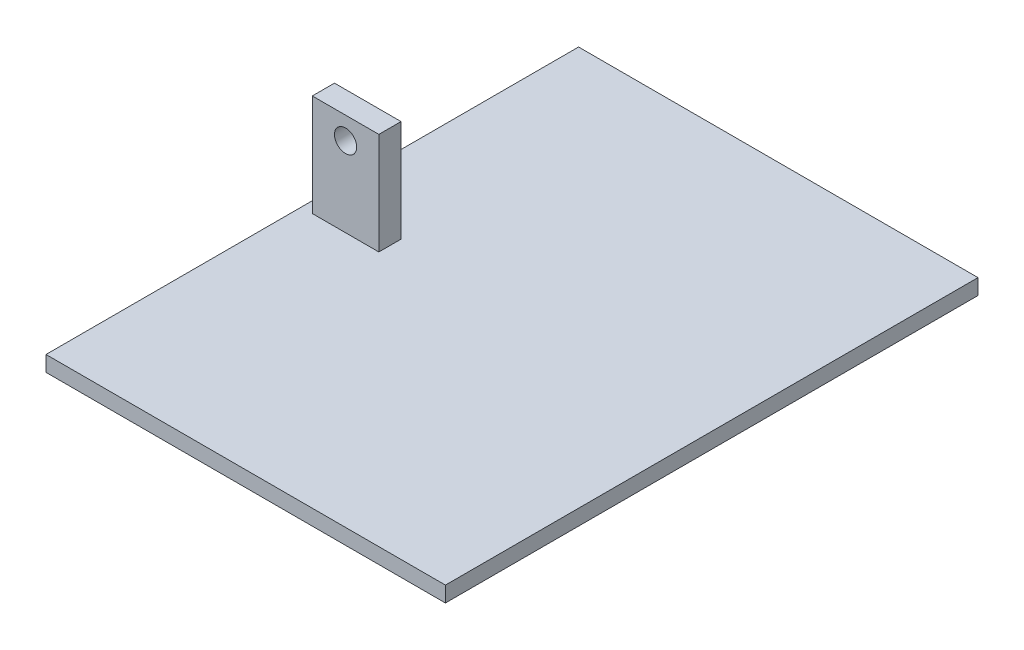
from build123d import *

# Parameters (mm, degrees)
SKETCH2_W               = 457.2
SKETCH2_H               = 609.6
SKETCH2_W_2             = 76.2
SKETCH2_H_2             = 25.4
BOSS_EXTRUDE1_DEPTH     = 17.78
SKETCH3_W               = 76.2
SKETCH3_H               = 25.4
BOSS_EXTRUDE2_DEPTH     = 116.586
SKETCH3_2_W             = 76.2
SKETCH3_2_H             = 25.4
BOSS_EXTRUDE3_DEPTH     = 17.78
CUT_EXTRUDE1_DEPTH      = 254
CUT_EXTRUDE1_DEPTH_BACK = 254
SKETCH4_R               = 12.7


with BuildPart() as part:
    # Sketch2 → Boss-Extrude1 (new body)
    with BuildSketch(Plane(origin=(0, 0, 0), x_dir=(1, 0, 0), z_dir=(0, 1, 0))):
        Rectangle(SKETCH2_W, SKETCH2_H)
        with Locations((-177.8, 0)):
            Rectangle(SKETCH2_W_2, SKETCH2_H_2, mode=Mode.SUBTRACT)
    extrude(amount=-BOSS_EXTRUDE1_DEPTH)



with BuildPart() as body_2:
    # Sketch3 → Boss-Extrude2 (new body)
    with BuildSketch(Plane(origin=(0, 0, 0), x_dir=(1, 0, 0), z_dir=(0, 1, 0))):
        with Locations((-177.8, 0)):
            Rectangle(SKETCH3_W, SKETCH3_H)
    extrude(amount=BOSS_EXTRUDE2_DEPTH)


with BuildPart() as part_1:
    add(part.part)

    add(body_2.part)  # Boss-Extrude3 merges body 2
    # Sketch3<2> → Boss-Extrude3 (add)
    with BuildSketch(Plane(origin=(0, 0, 0), x_dir=(1, 0, 0), z_dir=(0, 1, 0))):
        with Locations((-177.8, 0)):
            Rectangle(SKETCH3_2_W, SKETCH3_2_H)
    extrude(amount=-BOSS_EXTRUDE3_DEPTH)

    # Sketch4 → Cut-Extrude1 (cut, two sides: drawn at the far end of the back side and taken through both)
    with BuildSketch(Plane.XY.offset(-CUT_EXTRUDE1_DEPTH_BACK)):
        with Locations((-177.8, 91.186)):
            Circle(SKETCH4_R)
    extrude(amount=CUT_EXTRUDE1_DEPTH + CUT_EXTRUDE1_DEPTH_BACK, mode=Mode.SUBTRACT)


solid = part_1.part
